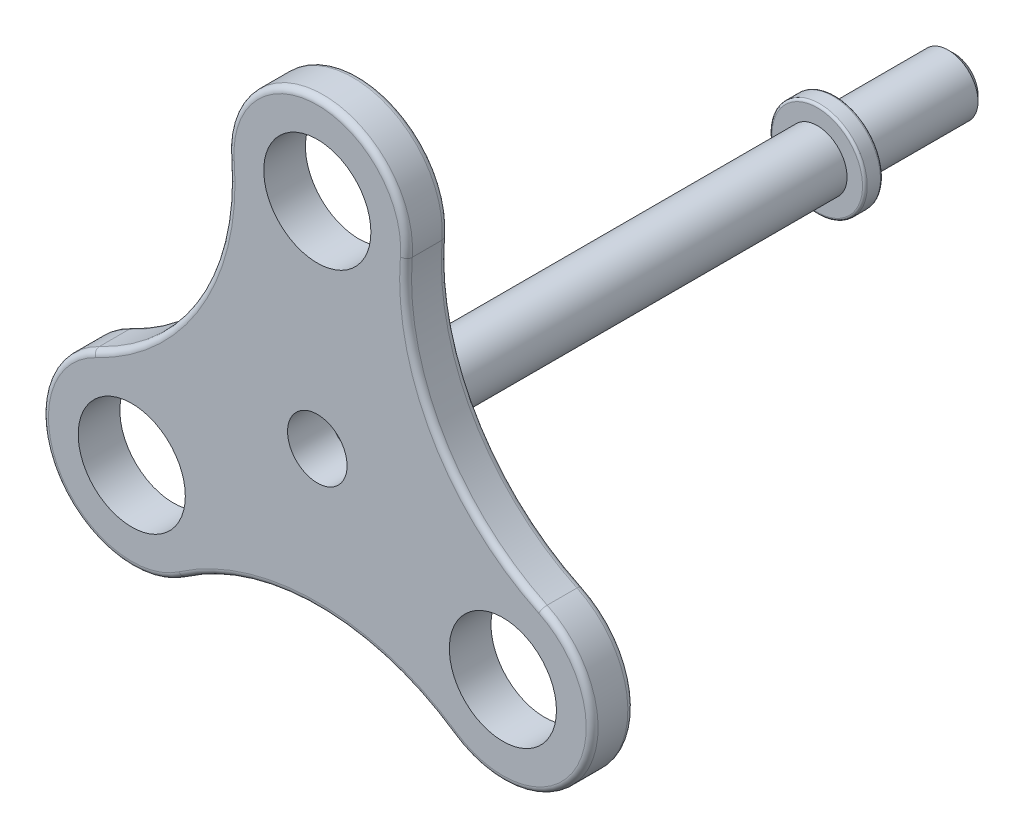
from build123d import *

# Parameters (mm, degrees)
SKETCH1_R               = 4.5
SKETCH1_R_2             = 2.5
BOSS_EXTRUDE1_DEPTH     = 3.5
SKETCH1_4_R             = 2.5
BOSS_EXTRUDE3_DEPTH     = 50
BOSS_EXTRUDE4_START     = -10
SKETCH5_R               = 4
SKETCH5_R_2             = 2.5
BOSS_EXTRUDE4_DEPTH     = 1.5
CUT_EXTRUDE2_REACH      = 67.69
CUT_EXTRUDE2_END_RADIUS = 2
CUT_EXTRUDE2_START      = -5
CHAMFER1_SIZE           = 0.5
FILLET1_R               = 0.2
FILLET2_R               = 0.5


with BuildPart() as part:
    # Sketch1 → Boss-Extrude1 (new body)
    with BuildSketch(Plane.XY):
        with BuildLine():
            ThreePointArc((7.476559852, 17.407502934), (0, 25.5), (-7.476559852, 17.407502934))
            ThreePointArc((-7.476559852, 17.407502934), (-10.093544717, 5.827510759), (-18.813619684, -2.228860702))
            ThreePointArc((-18.813619684, -2.228860702), (-22.083647797, -12.75), (-11.337059831, -15.178642232))
            ThreePointArc((-11.337059831, -15.178642232), (0, -11.655021518), (11.337059831, -15.178642232))
            ThreePointArc((11.337059831, -15.178642232), (22.083647797, -12.75), (18.813619684, -2.228860702))
            ThreePointArc((18.813619684, -2.228860702), (10.093544717, 5.827510759), (7.476559852, 17.407502934))
        make_face()
        with Locations((0, 18)):
            Circle(SKETCH1_R, mode=Mode.SUBTRACT)
        Circle(SKETCH1_R_2, mode=Mode.SUBTRACT)
        with Locations((-15.588457268, -9)):
            Circle(SKETCH1_R, mode=Mode.SUBTRACT)
        with Locations((15.588457268, -9)):
            Circle(SKETCH1_R, mode=Mode.SUBTRACT)
    extrude(amount=BOSS_EXTRUDE1_DEPTH)

    # Fillet2
    fillet2_edges = [part.edges().sort_by_distance(p)[0] for p in [
        (0, 25.5, 0),
        (-10.093544717, 5.827510759, 3.5),
        (10.093544717, 5.827510759, 0),
        (22.083647797, -12.75, 0),
        (0, -11.655021518, 0),
        (-22.083647797, -12.75, 0),
        (-10.093544717, 5.827510759, 0),
        (-22.083647797, -12.75, 3.5),
        (0, -11.655021518, 3.5),
        (22.083647797, -12.75, 3.5),
        (10.093544717, 5.827510759, 3.5),
        (0, 25.5, 3.5),
    ]]
    fillet(fillet2_edges, radius=FILLET2_R)


with BuildPart() as body_2:
    # Sketch1<4> → Boss-Extrude3 (new body)
    with BuildSketch(Plane.XY):
        Circle(SKETCH1_4_R)
    extrude(amount=-BOSS_EXTRUDE3_DEPTH)

    # Sketch5 → Boss-Extrude4 (add)
    # profile 1 of 2: a face of its own
    with BuildSketch(Plane(origin=(0, 0, -50), x_dir=(-1, 0, 0), z_dir=(0, 0, -1)).offset(BOSS_EXTRUDE4_START)):
        Circle(SKETCH5_R)
        with Locations(Location((0, 0, 0), (0, 0, 180))):
            Circle(SKETCH5_R_2, mode=Mode.SUBTRACT)
    # profile 2 of 2: a face of its own
    with BuildSketch(Plane(origin=(0, 0, -50), x_dir=(-1, 0, 0), z_dir=(0, 0, -1)).offset(BOSS_EXTRUDE4_START)):
        with Locations(Location((0, 0, 0), (0, 0, 180))):
            Circle(SKETCH5_R_2)
    extrude(amount=-BOSS_EXTRUDE4_DEPTH)

    # Cut-Extrude2: up to this cylinder (the profile starts outside it)
    cut_extrude2_end = Plane(origin=(0, 0, -45), z_dir=(0, 0, 1)) * Cylinder(CUT_EXTRUDE2_END_RADIUS, 140.38, mode=Mode.PRIVATE)
    # Sketch6 → Cut-Extrude2 (cut, up to the surface)
    with BuildSketch(Plane(origin=(0, 0, 0), x_dir=(0, 0, -1), z_dir=(1, 0, 0)).offset(CUT_EXTRUDE2_START), mode=Mode.PRIVATE) as cut_extrude2_sk1:
        with BuildLine():
            Line((42.5, 0.75), (47.5, 0.75))
            ThreePointArc((47.5, 0.75), (48.25, 0), (47.5, -0.75))
            Line((47.5, -0.75), (42.5, -0.75))
            ThreePointArc((42.5, -0.75), (41.75, 0), (42.5, 0.75))
        make_face()
    cut_extrude2_tool1 = extrude(cut_extrude2_sk1.sketch, amount=CUT_EXTRUDE2_REACH, mode=Mode.PRIVATE) - cut_extrude2_end
    add(cut_extrude2_tool1.solids().sort_by_distance((-5, 0, -45))[0], mode=Mode.SUBTRACT)

    # Chamfer1
    chamfer1_edges = [body_2.edges().sort_by_distance(p)[0] for p in [
        (-2.5, 0, -50),
    ]]
    chamfer(chamfer1_edges, length=CHAMFER1_SIZE)

    # Fillet1
    fillet1_edges = [body_2.edges().sort_by_distance(p)[0] for p in [
        (4, 0, -38.5),
        (4, 0, -40),
    ]]
    fillet(fillet1_edges, radius=FILLET1_R)


solid = Compound([part.part, body_2.part])
